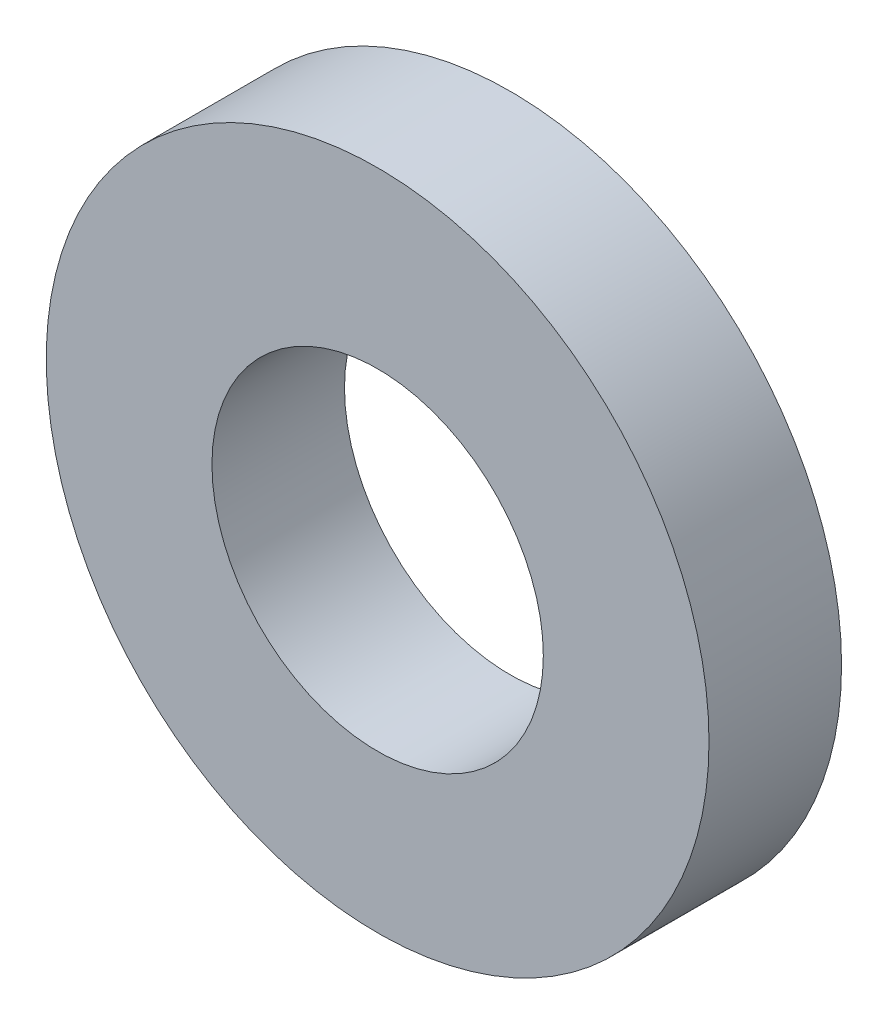
from build123d import *

# Parameters (mm, degrees)
SKETCH1_R           = 15.875
SKETCH1_R_2         = 7.9375
BOSS_EXTRUDE1_DEPTH = 6.35


with BuildPart() as part:
    # Sketch1 → Boss-Extrude1 (new body)
    with BuildSketch(Plane.XY):
        Circle(SKETCH1_R)
        with Locations((0, -0.403682053)):
            Circle(SKETCH1_R_2, mode=Mode.SUBTRACT)
    extrude(amount=BOSS_EXTRUDE1_DEPTH)


solid = part.part
